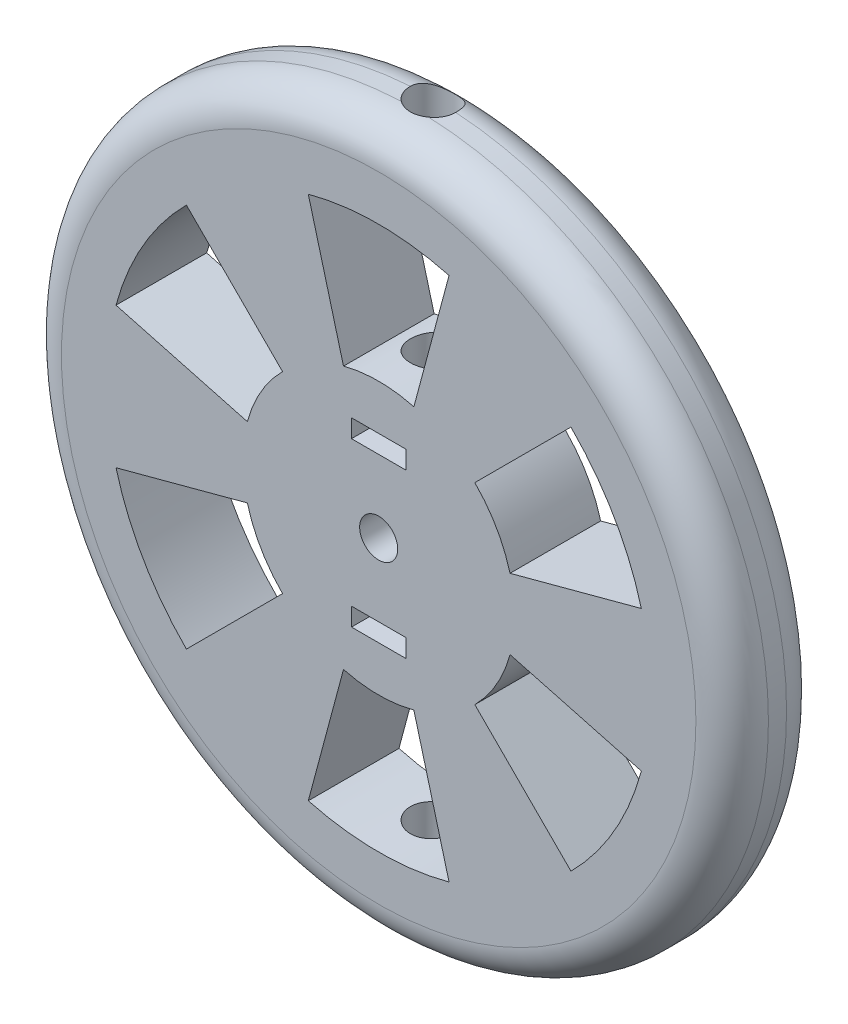
from build123d import *

# Parameters (mm, degrees)
SKETCH1_R               = 39
BOSS_EXTRUDE1_DEPTH     = 10
SKETCH2_R               = 2.1
CUT_EXTRUDE1_DEPTH      = 57.053545829
FILLET1_R               = 4
CUT_EXTRUDE2_DEPTH      = 57.053545829
SKETCH4_W               = 6
SKETCH4_H               = 2
CUT_EXTRUDE3_DEPTH      = 57.053545829
CUT_EXTRUDE4_DEPTH      = 62.886993787
CUT_EXTRUDE4_DEPTH_BACK = 62.886993787
SKETCH5_R               = 2.5


with BuildPart() as part:
    # Sketch1 → Boss-Extrude1 (new body)
    with BuildSketch(Plane.XY):
        Circle(SKETCH1_R)
    extrude(amount=BOSS_EXTRUDE1_DEPTH)

    # Sketch2 → Cut-Extrude1 (cut, through all)
    with BuildSketch(Plane.XY.offset(10)):
        Circle(SKETCH2_R)
    extrude(amount=-CUT_EXTRUDE1_DEPTH, mode=Mode.SUBTRACT)

    # Fillet1
    fillet1_edges = [part.edges().sort_by_distance(p)[0] for p in [
        (-39, 0, 0),
        (-39, 0, 10),
    ]]
    fillet(fillet1_edges, radius=FILLET1_R)

    # Sketch3 → Cut-Extrude2 (cut, through all)
    with BuildSketch(Plane.XY.offset(10)):
        with BuildLine():
            Line((7.764571353, 28.977774789), (3.882285677, 14.488887394))
            ThreePointArc((3.882285677, 14.488887394), (0, 15), (-3.882285677, 14.488887394))
            Line((-3.882285677, 14.488887394), (-7.764571353, 28.977774789))
            ThreePointArc((-7.764571353, 28.977774789), (0, 30), (7.764571353, 28.977774789))
        make_face()
        with BuildLine():
            Line((21.213203436, 21.213203436), (10.606601718, 10.606601718))
            ThreePointArc((10.606601718, 10.606601718), (12.990381057, 7.5), (14.488887394, 3.882285677))
            Line((14.488887394, 3.882285677), (28.977774789, 7.764571353))
            ThreePointArc((28.977774789, 7.764571353), (25.980762114, 15), (21.213203436, 21.213203436))
        make_face()
        with BuildLine():
            Line((28.977774789, -7.764571353), (14.488887394, -3.882285677))
            ThreePointArc((14.488887394, -3.882285677), (12.990381057, -7.5), (10.606601718, -10.606601718))
            Line((10.606601718, -10.606601718), (21.213203436, -21.213203436))
            ThreePointArc((21.213203436, -21.213203436), (25.980762114, -15), (28.977774789, -7.764571353))
        make_face()
        with BuildLine():
            Line((7.764571353, -28.977774789), (3.882285677, -14.488887394))
            ThreePointArc((3.882285677, -14.488887394), (0, -15), (-3.882285677, -14.488887394))
            Line((-3.882285677, -14.488887394), (-7.764571353, -28.977774789))
            ThreePointArc((-7.764571353, -28.977774789), (0, -30), (7.764571353, -28.977774789))
        make_face()
        with BuildLine():
            Line((-21.213203436, -21.213203436), (-10.606601718, -10.606601718))
            ThreePointArc((-10.606601718, -10.606601718), (-12.990381057, -7.5), (-14.488887394, -3.882285677))
            Line((-14.488887394, -3.882285677), (-28.977774789, -7.764571353))
            ThreePointArc((-28.977774789, -7.764571353), (-25.980762114, -15), (-21.213203436, -21.213203436))
        make_face()
        with BuildLine():
            Line((-28.977774789, 7.764571353), (-14.488887394, 3.882285677))
            ThreePointArc((-14.488887394, 3.882285677), (-12.990381057, 7.5), (-10.606601718, 10.606601718))
            Line((-10.606601718, 10.606601718), (-21.213203436, 21.213203436))
            ThreePointArc((-21.213203436, 21.213203436), (-25.980762114, 15), (-28.977774789, 7.764571353))
        make_face()
    extrude(amount=-CUT_EXTRUDE2_DEPTH, mode=Mode.SUBTRACT)

    # Sketch4 → Cut-Extrude3 (cut, through all)
    with BuildSketch(Plane.XY.offset(10)):
        with Locations((0, 9)):
            Rectangle(SKETCH4_W, SKETCH4_H)
        with Locations((0, -9)):
            Rectangle(SKETCH4_W, SKETCH4_H)
    extrude(amount=-CUT_EXTRUDE3_DEPTH, mode=Mode.SUBTRACT)

    # Sketch5 → Cut-Extrude4 (cut, two sides: drawn at the far end of the back side and taken through both)
    with BuildSketch(Plane(origin=(0, 8, 0), x_dir=(1, 0, 0), z_dir=(0, 1, 0)).offset(-CUT_EXTRUDE4_DEPTH_BACK)):
        with Locations(Location((0, -4, 0), (0, 0, 270))):
            Circle(SKETCH5_R)
    extrude(amount=CUT_EXTRUDE4_DEPTH + CUT_EXTRUDE4_DEPTH_BACK, mode=Mode.SUBTRACT)


solid = part.part
